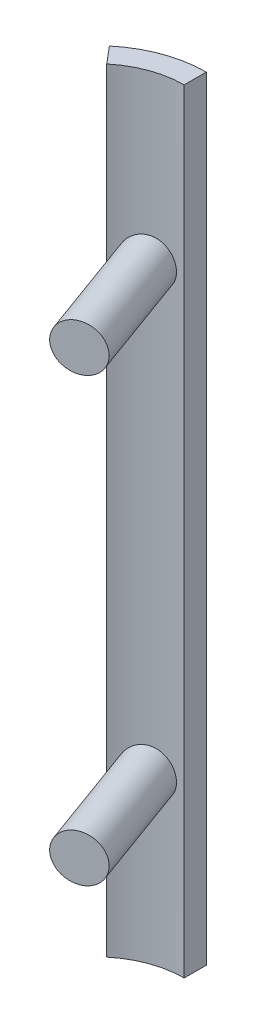
from build123d import *

# Parameters (mm, degrees)
SKETCH1_W                = 10
SKETCH1_H                = 70
REVOLVE1_ANGLE           = 40
CUT_EXTRUDE1_DEPTH       = 72.002236522
BOSS_EXTRUDE1_REACH      = 73.45
BOSS_EXTRUDE1_END_RADIUS = 8
SKETCH4_R                = 2.1


with BuildPart() as part:
    # Sketch1 → Revolve1 (revolve)
    with BuildSketch(Plane(origin=(0, 0, 0), x_dir=(0, 0, -1), z_dir=(1, 0, 0))):
        with Locations((5, 35)):
            Rectangle(SKETCH1_W, SKETCH1_H)
    revolve(axis=Axis((0, 0, 0), (0, 1, 0)), revolution_arc=REVOLVE1_ANGLE)

    # Sketch2 → Cut-Extrude1 (cut, through all)
    with BuildSketch(Plane(origin=(0, 70, 0), x_dir=(1, 0, 0), z_dir=(0, 1, 0))):
        with BuildLine():
            Line((-5.142300877, 6.128355545), (0, 0))
            Line((0, 0), (0, 8))
            ThreePointArc((0, 8), (-2.736161147, 7.517540966), (-5.142300877, 6.128355545))
        make_face()
    extrude(amount=-CUT_EXTRUDE1_DEPTH, mode=Mode.SUBTRACT)

    # Boss-Extrude1: up to this cylinder (the profile starts inside it)
    boss_extrude1_end = Plane(origin=(0, 35, 0), z_dir=(0, 1, 0)) * Cylinder(BOSS_EXTRUDE1_END_RADIUS, 203.9, mode=Mode.PRIVATE)
    # Sketch4 → Boss-Extrude1 (add, up to the surface)
    with BuildSketch(Plane(origin=(0.849050995, 0, 2.332748435), x_dir=(0.9396926207859081, 0, -0.34202014332566977), z_dir=(0.34202014332566977, 0, 0.9396926207859081)), mode=Mode.PRIVATE) as boss_extrude1_sk1:
        with Locations((0, 55)):
            Circle(SKETCH4_R)
    boss_extrude1_tool1 = extrude(boss_extrude1_sk1.sketch, amount=-BOSS_EXTRUDE1_REACH, mode=Mode.PRIVATE) & boss_extrude1_end
    add(boss_extrude1_tool1.solids().sort_by_distance((0.849051, 55, 2.332748))[0])
    # Sketch4 → Boss-Extrude1 (add, up to the surface)
    with BuildSketch(Plane(origin=(0.849050995, 0, 2.332748435), x_dir=(0.9396926207859081, 0, -0.34202014332566977), z_dir=(0.34202014332566977, 0, 0.9396926207859081)), mode=Mode.PRIVATE) as boss_extrude1_sk2:
        with Locations((0, 15)):
            Circle(SKETCH4_R)
    boss_extrude1_tool2 = extrude(boss_extrude1_sk2.sketch, amount=-BOSS_EXTRUDE1_REACH, mode=Mode.PRIVATE) & boss_extrude1_end
    add(boss_extrude1_tool2.solids().sort_by_distance((0.849051, 15, 2.332748))[0])


solid = part.part
